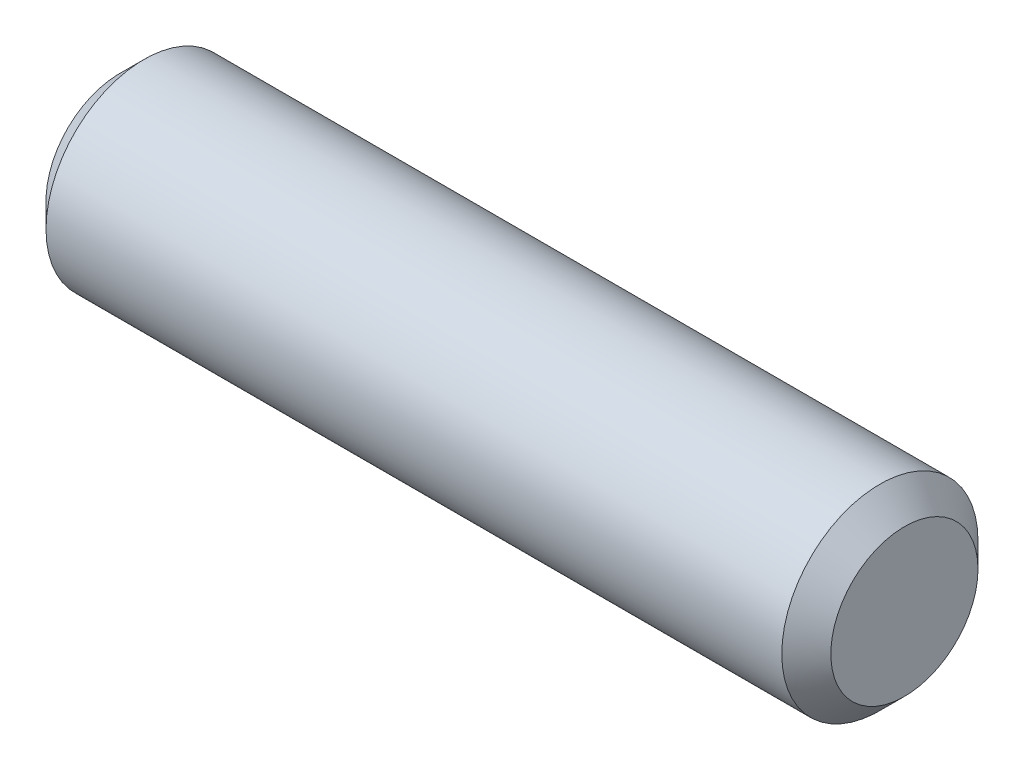
from build123d import *

# Parameters (mm, degrees)
SKETCH_1_R      = 4
EXTRUDE_1_DEPTH = 16
CHAMFER_1_SIZE  = 1


with BuildPart() as part:
    # 草图1 → 凸台-拉伸1 (new, symmetric)
    with BuildSketch(Plane(origin=(0, 0, 0), x_dir=(0, 0, -1), z_dir=(1, 0, 0))):
        Circle(SKETCH_1_R)
    extrude(amount=EXTRUDE_1_DEPTH, both=True)

    # 倒角1
    chamfer_1_edges = [part.edges().sort_by_distance(p)[0] for p in [
        (-16, 0, 4),
        (16, 0, 4),
    ]]
    chamfer(chamfer_1_edges, length=CHAMFER_1_SIZE)


solid = part.part
